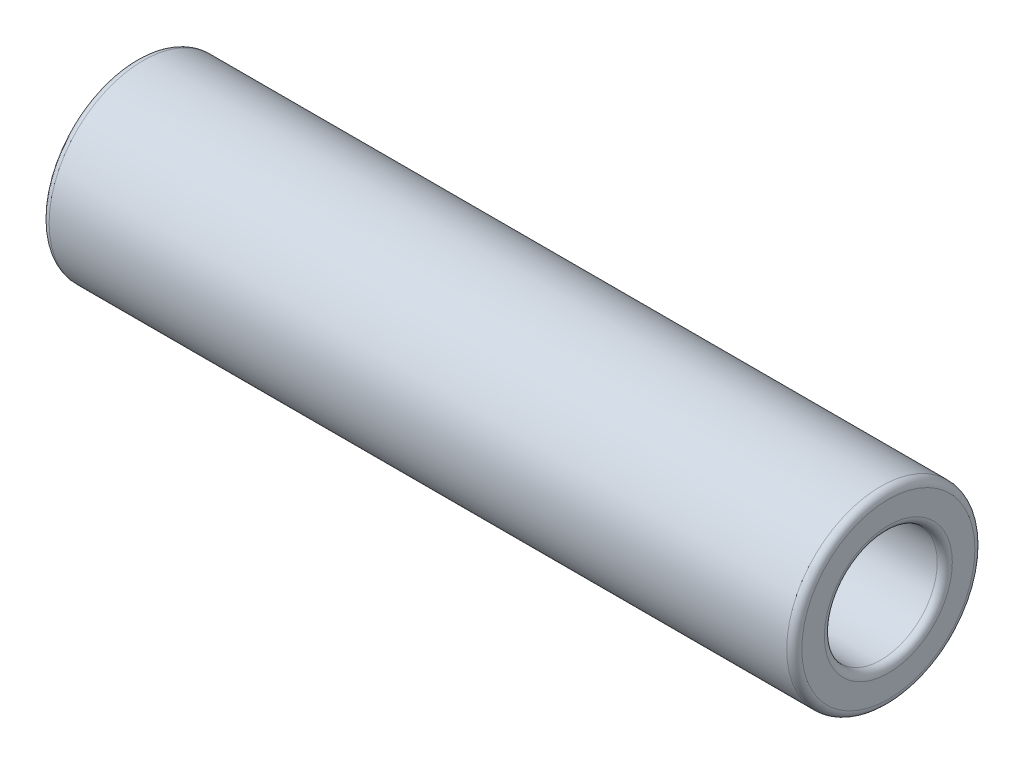
from build123d import *

# Parameters (mm, degrees)
SKETCH2_R           = 6.25
SKETCH2_R_2         = 3.75
BOSS_EXTRUDE1_DEPTH = 50
FILLET1_R           = 0.5


with BuildPart() as part:
    # Sketch2 → Boss-Extrude1 (new body)
    with BuildSketch(Plane(origin=(0, 0, 0), x_dir=(0, 0, -1), z_dir=(1, 0, 0))):
        Circle(SKETCH2_R)
        Circle(SKETCH2_R_2, mode=Mode.SUBTRACT)
    extrude(amount=BOSS_EXTRUDE1_DEPTH)

    # Fillet1
    fillet1_edges = [part.edges().sort_by_distance(p)[0] for p in [
        (0, 0, 6.25),
        (50, 0, 6.25),
        (0, 0, 3.75),
        (50, 0, 3.75),
    ]]
    fillet(fillet1_edges, radius=FILLET1_R)


solid = part.part
